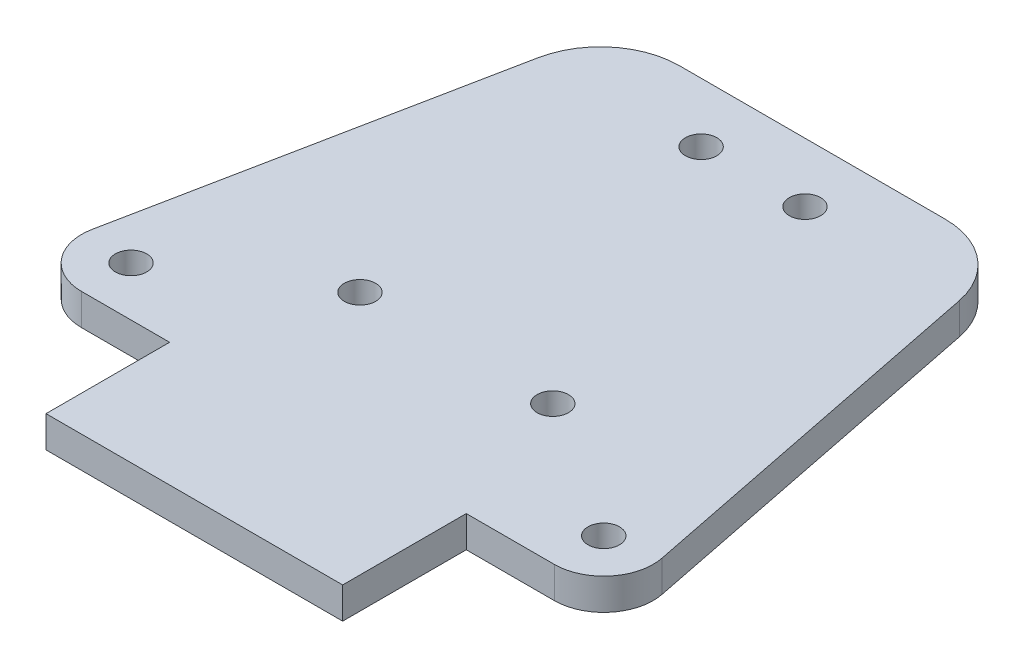
from build123d import *

# Parameters (mm, degrees)
CROQUIS1_R              = 1.5875
SALIENTE_EXTRUIR1_DEPTH = 3.175
CROQUIS2_R              = 1.5875
CORTAR_EXTRUIR1_DEPTH   = 3.175
CROQUIS3_W              = 30
CROQUIS3_H              = 12.5
SALIENTE_EXTRUIR2_DEPTH = 3.175


with BuildPart() as part:
    # Croquis1 → Saliente-Extruir1 (new body)
    with BuildSketch(Plane(origin=(0, 0, 0), x_dir=(1, 0, 0), z_dir=(0, 1, 0))):
        with BuildLine():
            Line((8.713785816, 43.568929081), (0, 0))
            Line((0, 0), (60, 0))
            Line((60, 0), (51.286214184, 43.568929081))
            ThreePointArc((51.286214184, 43.568929081), (48.513480023, 48.186737131), (43.441568778, 50))
            Line((43.441568778, 50), (16.558431222, 50))
            ThreePointArc((16.558431222, 50), (11.486519977, 48.186737131), (8.713785816, 43.568929081))
        make_face()
        with Locations(Location((39.75, 14, 0), (0, 0, 270))):
            Circle(CROQUIS1_R, mode=Mode.SUBTRACT)
        with Locations(Location((20.25, 14, 0), (0, 0, 270))):
            Circle(CROQUIS1_R, mode=Mode.SUBTRACT)
        with Locations(Location((24.75, 44, 0), (0, 0, 270))):
            Circle(CROQUIS1_R, mode=Mode.SUBTRACT)
        with Locations(Location((35.25, 44, 0), (0, 0, 270))):
            Circle(CROQUIS1_R, mode=Mode.SUBTRACT)
    extrude(amount=SALIENTE_EXTRUIR1_DEPTH)

    # Croquis2 → Cortar-Extruir1 (cut)
    with BuildSketch(Plane(origin=(0, 3.175, 0), x_dir=(1, 0, 0), z_dir=(0, 1, 0))):
        with Locations(Location((6.099019514, 5, 0), (0, 0, 270))):
            Circle(CROQUIS2_R)
        with Locations(Location((53.900980486, 5, 0), (0, 0, 270))):
            Circle(CROQUIS2_R)
        with BuildLine():
            Line((53.900980486, 0), (60, 0))
            Line((60, 0), (58.803883865, 5.980580676))
            ThreePointArc((58.803883865, 5.980580676), (57.767691193, 1.830055472), (53.900980486, 0))
        make_face()
        with BuildLine():
            Line((1.196116135, 5.980580676), (0, 0))
            Line((0, 0), (6.099019514, 0))
            ThreePointArc((6.099019514, 0), (2.232308807, 1.830055472), (1.196116135, 5.980580676))
        make_face()
    extrude(amount=-CORTAR_EXTRUIR1_DEPTH, mode=Mode.SUBTRACT)

    # Croquis3 → Saliente-Extruir2 (add)
    with BuildSketch(Plane(origin=(0, 3.175, 0), x_dir=(1, 0, 0), z_dir=(0, 1, 0))):
        with Locations((30, -6.25)):
            Rectangle(CROQUIS3_W, CROQUIS3_H)
    extrude(amount=-SALIENTE_EXTRUIR2_DEPTH)


solid = part.part
